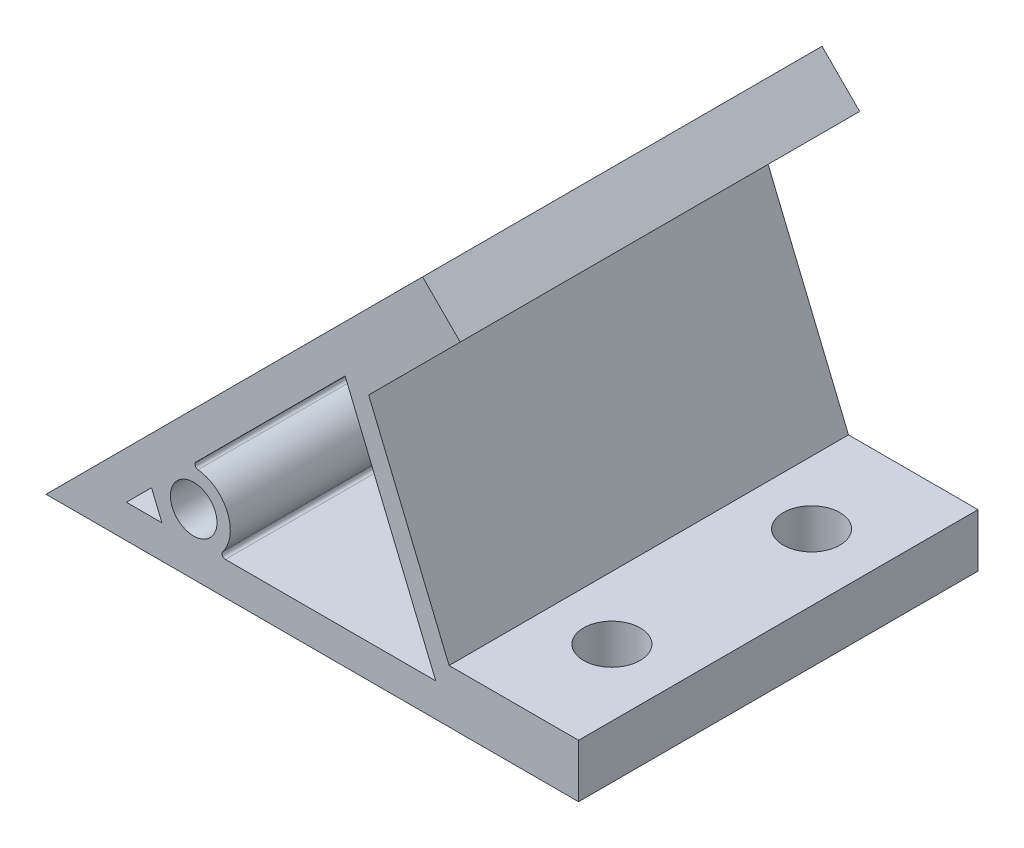
from build123d import *

# Parameters (mm, degrees)
SKETCH_1_R          = 3.5
EXTRUDE_1_DEPTH     = 30
SKETCH_2_R          = 4.25
CUT_EXTRUDE_1_DEPTH = 20
SKETCH_3_R          = 4.25
CUT_EXTRUDE_2_DEPTH = 20


with BuildPart() as part:
    # 草图1 → 凸台-拉伸1 (new, symmetric)
    with BuildSketch(Plane.XY):
        Polygon((0, 0), (56.568542495, 56.568542495), (62.225396744, 50.911688245), (48.470353518, 37.156645019), (60.547431318, 8), (80, 8), (80, 0), align=None)
        with Locations((22.184677187, 9.156473773)):
            Circle(SKETCH_1_R, mode=Mode.SUBTRACT)
        Polygon((12.071067812, 5), (15.847671377, 8.776603565), (17.411991793, 5), align=None, mode=Mode.SUBTRACT)
        with BuildLine():
            Line((22.539170943, 15.468103131), (44.931612237, 37.860544425))
            Line((44.931612237, 37.860544425), (58.542895405, 5))
            Line((58.542895405, 5), (26.941798117, 5))
            ThreePointArc((26.941798117, 5), (26.493271042, 5.27903968), (26.545371373, 5.804706148))
            ThreePointArc((26.545371373, 5.804706148), (27.253512915, 11.291164467), (22.833720405, 14.61804341))
            ThreePointArc((22.833720405, 14.61804341), (22.420282519, 14.950846558), (22.539170943, 15.468103131))
        make_face(mode=Mode.SUBTRACT)
    extrude(amount=EXTRUDE_1_DEPTH, both=True)

    # 草图2 → 切除-拉伸1 (cut)
    with BuildSketch(Plane(origin=(0, 0, 0), x_dir=(0, 0, 1), z_dir=(-0.7071067811865488, 0.7071067811865464, 0))):
        with Locations(Location((-15, 70, 0), (0, 0, 270))):
            Circle(SKETCH_2_R)
        with Locations(Location((15, 70, 0), (0, 0, 270))):
            Circle(SKETCH_2_R)
    extrude(amount=-CUT_EXTRUDE_1_DEPTH, mode=Mode.SUBTRACT)

    # 草图3 → 切除-拉伸2 (cut)
    with BuildSketch(Plane.XZ):
        with Locations(Location((70, 15, 0), (0, 0, 270))):
            Circle(SKETCH_3_R)
        with Locations(Location((70, -15, 0), (0, 0, 270))):
            Circle(SKETCH_3_R)
    extrude(amount=-CUT_EXTRUDE_2_DEPTH, mode=Mode.SUBTRACT)


solid = part.part
